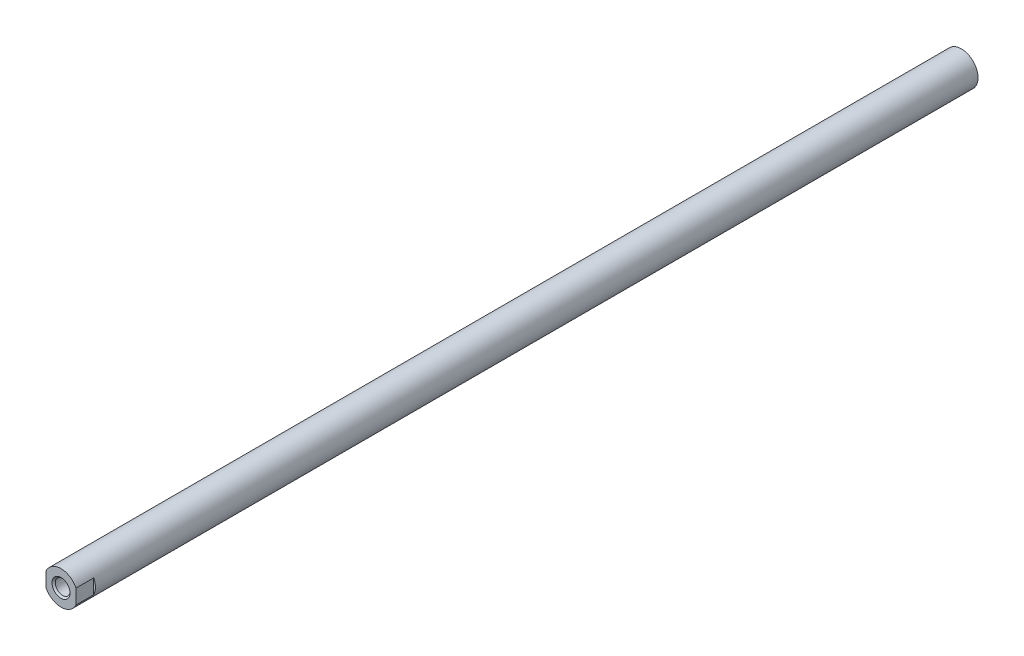
from build123d import *

# Parameters (mm, degrees)
SKETCH1_W          = 5.564434946
SKETCH1_H          = 300
CUT_EXTRUDE1_DEPTH = 5.9
CUT_EXTRUDE2_DEPTH = 5.9
HOLE1_D            = 4.92
HOLE1_DEPTH        = 10.5
HOLE1_TIP          = 1.420281662
CHAMFER2_SIZE      = 0.54


with BuildPart() as part:
    # Sketch1 → Revolve1 (revolve)
    with BuildSketch(Plane.XZ, mode=Mode.PRIVATE) as revolve1_sk:
        with Locations((2.782217473, -144.435565054)):
            Rectangle(SKETCH1_W, SKETCH1_H)
    revolve(revolve1_sk.sketch.rotate(Axis((0, 0, 5.564434946), (0, 0, -1)), 180), axis=Axis((0, 0, 5.564434946), (0, 0, -1)))

    # Sketch2 → Cut-Extrude1 (cut)
    with BuildSketch(Plane.XY.offset(5.564434946)):
        with BuildLine():
            Line((-5, -3.31662479), (-5, 3.31662479))
            ThreePointArc((-5, 3.31662479), (-6, 0), (-5, -3.31662479))
        make_face()
    extrude(amount=-CUT_EXTRUDE1_DEPTH, mode=Mode.SUBTRACT)

    # Sketch3 → Cut-Extrude2 (cut)
    with BuildSketch(Plane.XY.offset(5.564434946)):
        with BuildLine():
            Line((5, 3.31662479), (5, -3.31662479))
            ThreePointArc((5, -3.31662479), (6, 0), (5, 3.31662479))
        make_face()
    extrude(amount=-CUT_EXTRUDE2_DEPTH, mode=Mode.SUBTRACT)

    # Hole1
    with Locations(Plane.XY.offset(5.564434946)):
        with Locations((0, 0)):
            Hole(HOLE1_D / 2, depth=HOLE1_DEPTH)
            with Locations((0, 0, -(HOLE1_DEPTH + HOLE1_TIP / 2))):  # 120° drill point
                Cone(0, HOLE1_D / 2, HOLE1_TIP, mode=Mode.SUBTRACT)

    # Chamfer2
    chamfer2_edges = [part.edges().sort_by_distance(p)[0] for p in [
        (2.46, 0, 5.564434946),
    ]]
    chamfer(chamfer2_edges, length=CHAMFER2_SIZE)


solid = part.part
